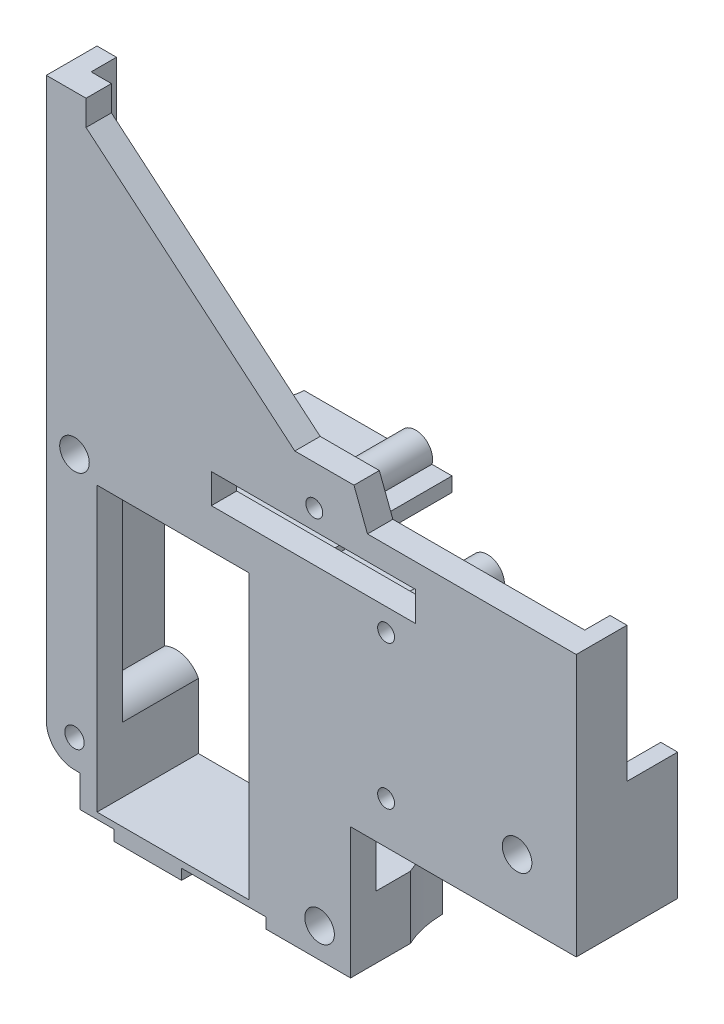
from build123d import *

# Parameters (mm, degrees)
ESQUISSE1_R                   = 1.15
ESQUISSE1_R_2                 = 1.75
ESQUISSE1_R_3                 = 1
ESQUISSE1_W                   = 18
ESQUISSE1_H                   = 33.5
BOSS_EXTRU_2_DEPTH            = 12
ENL_V_MAT_EXTRU_1_DEPTH       = 75.057589753
ESQUISSE3_W                   = 2.3
ESQUISSE3_H                   = 33.5
ESQUISSE3_W_2                 = 2
ESQUISSE3_H_2                 = 16
ENL_V_MAT_EXTRU_2_DEPTH       = 74.753146373
CONG_1_R                      = 3
ENL_V_MAT_EXTRU_3_REACH       = 62.317
ESQUISSE4_R                   = 2.2
ENL_V_MAT_EXTRU_4_REACH       = 67.556
ESQUISSE5_R                   = 3.5
ESQUISSE6_R                   = 3.5
ENL_V_MAT_EXTRU_5_DEPTH       = 5
ESQUISSE7_W                   = 8.040923999
ESQUISSE7_H                   = 1.8
ENL_V_MAT_EXTRU_6_DEPTH       = 1
ENL_V_MAT_EXTRU_7_DEPTH       = 3
ENL_V_MAT_EXTRU_7_DEPTH_BACK  = 75.185757393
ESQUISSE8_W                   = 24.177827552
ESQUISSE8_H                   = 3.5
ENL_V_MAT_EXTRU_8_REACH       = 72.034
ENL_V_MAT_EXTRU_9_REACH       = 76.033
ESQUISSE10_R                  = 4
ESQUISSE11_R                  = 12.099999999
ENL_V_MAT_EXTRU_10_DEPTH      = 76.583950893
ENL_V_MAT_EXTRU_11_DEPTH      = 38
ENL_V_MAT_EXTRU_11_DEPTH_BACK = 1
ESQUISSE17_R                  = 1.5
ENL_V_MAT_EXTRU_12_DEPTH      = 13
ENL_V_MAT_EXTRU_12_DEPTH_BACK = 1.2
ESQUISSE18_R                  = 1.5


with BuildPart() as part:
    # Esquisse1 → Boss.-Extru.2 (new body)
    with BuildSketch(Plane.XY):
        with BuildLine():
            Line((-12.306087575, 57.58118588), (-12.306087575, 54.58118588))
            Line((-12.306087575, 54.58118588), (12.393912425, 33.78118588))
            Line((12.393912425, 33.78118588), (19.393912425, 33.78118588))
            Line((19.393912425, 33.78118588), (20.993912425, 29.58118588))
            Line((20.993912425, 29.58118588), (45.693912425, 29.58118588))
            Line((45.693912425, 29.58118588), (45.693912425, -1.41881412))
            Line((45.693912425, -1.41881412), (18.993912425, -1.41881412))
            Line((18.993912425, -1.41881412), (18.993912425, -16.91881412))
            Line((18.993912425, -16.91881412), (8.993912425, -16.91881412))
            Line((8.993912425, -16.91881412), (8.993912425, -15.66881412))
            Line((8.993912425, -15.66881412), (-1.006087575, -15.66881412))
            Line((-1.006087575, -15.66881412), (-1.006087575, -16.91881412))
            Line((-1.006087575, -16.91881412), (-9.006087575, -16.91881412))
            Line((-9.006087575, -16.91881412), (-9.006087575, -15.66881412))
            Line((-9.006087575, -15.66881412), (-13.006087575, -15.66881412))
            Line((-13.006087575, -15.66881412), (-13.006087575, -11.91881412))
            Line((-13.006087575, -11.91881412), (-13.676087575, -11.91881412))
            ThreePointArc((-13.676087575, -11.91881412), (-16.030753157, -10.943479702), (-17.006087575, -8.58881412))
            Line((-17.006087575, -8.58881412), (-17.006087575, 57.58118588))
            Line((-17.006087575, 57.58118588), (-12.306087575, 57.58118588))
        make_face()
        with Locations((-13.676087575, -8.58881412)):
            Circle(ESQUISSE1_R, mode=Mode.SUBTRACT)
        with Locations((-13.676087575, 20.41118588)):
            Circle(ESQUISSE1_R_2, mode=Mode.SUBTRACT)
        with Locations((15.323912425, -13.41881412)):
            Circle(ESQUISSE1_R_2, mode=Mode.SUBTRACT)
        with Locations((38.693912425, 5.58118588)):
            Circle(ESQUISSE1_R_2, mode=Mode.SUBTRACT)
        with Locations((23.193912425, 3.58118588)):
            Circle(ESQUISSE1_R_3, mode=Mode.SUBTRACT)
        with Locations((23.193912425, 20.58118588)):
            Circle(ESQUISSE1_R_3, mode=Mode.SUBTRACT)
        with Locations((14.693912425, 29.08118588)):
            Circle(ESQUISSE1_R_3, mode=Mode.SUBTRACT)
        with Locations((-2.006087575, 1.83118588)):
            Rectangle(ESQUISSE1_W, ESQUISSE1_H, mode=Mode.SUBTRACT)
    extrude(amount=BOSS_EXTRU_2_DEPTH)

    # Esquisse2 → Enlèv. mat.-Extru.1 (cut, through all)
    # profile 1 of 4: a face of its own
    with BuildSketch(Plane.XY.offset(9)):
        with BuildLine():
            ThreePointArc((25.047962046, 19.83118588), (23.193912425, 22.58118588), (21.339862803, 19.83118588))
            Line((21.339862803, 19.83118588), (11.493912425, 19.83118588))
            Line((11.493912425, 19.83118588), (11.493912425, 20.58118588))
            Line((11.493912425, 20.58118588), (-10.010027019, 20.58118588))
            ThreePointArc((-10.010027019, 20.58118588), (-11.141822396, 23.065691483), (-13.676087575, 24.08118588))
            Line((-13.676087575, 24.08118588), (-14.706087575, 24.08118588))
            Line((-14.706087575, 24.08118588), (-14.706087575, 57.58118588))
            Line((-14.706087575, 57.58118588), (-12.306087575, 57.58118588))
            Line((-12.306087575, 57.58118588), (-12.306087575, 54.58118588))
            Line((-12.306087575, 54.58118588), (12.393912425, 33.78118588))
            Line((12.393912425, 33.78118588), (19.393912425, 33.78118588))
            Line((19.393912425, 33.78118588), (20.993912425, 29.58118588))
            Line((20.993912425, 29.58118588), (43.693912425, 29.58118588))
            Line((43.693912425, 29.58118588), (43.693912425, 6.58118588))
            Line((43.693912425, 6.58118588), (42.048014391, 6.58118588))
            ThreePointArc((42.048014391, 6.58118588), (38.693912425, 9.08118588), (35.339810458, 6.58118588))
            Line((35.339810458, 6.58118588), (26.693912425, 6.58118588))
            Line((26.693912425, 6.58118588), (26.693912425, 5.88118588))
            Line((26.693912425, 5.88118588), (6.993912425, 5.88118588))
            Line((6.993912425, 5.88118588), (6.993912425, 15.83118588))
            Line((6.993912425, 15.83118588), (11.493912425, 15.83118588))
            Line((11.493912425, 15.83118588), (11.493912425, 17.83118588))
            Line((11.493912425, 17.83118588), (31.493912425, 17.83118588))
            Line((31.493912425, 17.83118588), (31.493912425, 19.83118588))
            Line((31.493912425, 19.83118588), (25.047962046, 19.83118588))
        make_face()
        with BuildLine():
            ThreePointArc((16.616800877, 28.53118588), (14.693912425, 31.08118588), (12.771023972, 28.53118588))
            Line((12.771023972, 28.53118588), (-2.006087575, 28.53118588))
            Line((-2.006087575, 28.53118588), (-2.006087575, 26.83118588))
            Line((-2.006087575, 26.83118588), (18.993912425, 26.83118588))
            Line((18.993912425, 26.83118588), (18.993912425, 28.53118588))
            Line((18.993912425, 28.53118588), (16.616800877, 28.53118588))
        make_face(mode=Mode.SUBTRACT)
    # profile 2 of 4: a face of its own
    with BuildSketch(Plane.XY.offset(9)):
        with BuildLine():
            ThreePointArc((20.964002112, 3.88118588), (21.206819115, 2.52574276), (22.193912425, 1.565621443))
            Line((22.193912425, 1.565621443), (22.193912425, 0.58118588))
            Line((22.193912425, 0.58118588), (18.993912425, 0.58118588))
            Line((18.993912425, 0.58118588), (18.993912425, -9.51881412))
            Line((18.993912425, -9.51881412), (9.993912425, -9.51881412))
            Line((9.993912425, -9.51881412), (9.993912425, -14.91881412))
            Line((9.993912425, -14.91881412), (6.993912425, -14.91881412))
            Line((6.993912425, -14.91881412), (6.993912425, 3.88118588))
            Line((6.993912425, 3.88118588), (20.964002112, 3.88118588))
        make_face()
    # profile 3 of 4: a face of its own
    with BuildSketch(Plane.XY.offset(9)):
        with BuildLine():
            ThreePointArc((-15.006087575, 17.173733177), (-12.847657165, 17.010641356), (-11.006087575, 18.148201125))
            Line((-11.006087575, 18.148201125), (-11.006087575, -7.220932547))
            ThreePointArc((-11.006087575, -7.220932547), (-12.735191712, -5.740180242), (-15.006087575, -5.899743649))
            Line((-15.006087575, -5.899743649), (-15.006087575, 17.173733177))
        make_face()
    # profile 4 of 4: a face of its own
    with BuildSketch(Plane.XY.offset(9)):
        with BuildLine():
            ThreePointArc((24.193912425, 1.565621443), (25.181005734, 2.52574276), (25.423822737, 3.88118588))
            Line((25.423822737, 3.88118588), (29.193912425, 3.88118588))
            Line((29.193912425, 3.88118588), (29.193912425, 4.58118588))
            Line((29.193912425, 4.58118588), (35.339810458, 4.58118588))
            ThreePointArc((35.339810458, 4.58118588), (38.693912425, 2.08118588), (42.048014391, 4.58118588))
            Line((42.048014391, 4.58118588), (43.693912425, 4.58118588))
            Line((43.693912425, 4.58118588), (43.693912425, 0.58118588))
            Line((43.693912425, 0.58118588), (24.193912425, 0.58118588))
            Line((24.193912425, 0.58118588), (24.193912425, 1.565621443))
        make_face()
    extrude(amount=-ENL_V_MAT_EXTRU_1_DEPTH, mode=Mode.SUBTRACT)

    # Esquisse3 → Enlèv. mat.-Extru.2 (cut, through all)
    with BuildSketch(Plane.XY.offset(6)):
        with Locations((-15.856087575, 40.83118588)):
            Rectangle(ESQUISSE3_W, ESQUISSE3_H)
        with Locations((44.693912425, 21.58118588)):
            Rectangle(ESQUISSE3_W_2, ESQUISSE3_H_2)
    extrude(amount=-ENL_V_MAT_EXTRU_2_DEPTH, mode=Mode.SUBTRACT)

    # Congé1
    cong_1_edges = [part.edges().sort_by_distance(p)[0] for p in [
        (9.993912425, -9.51881412, 4.5),
    ]]
    fillet(cong_1_edges, radius=CONG_1_R)

    # Esquisse4 → Enlèv. mat.-Extru.3 (cut, up to next)
    with BuildSketch(Plane(origin=(0, 20.58118588, 0), x_dir=(1, 0, 0), z_dir=(0, 1, 0)), mode=Mode.PRIVATE) as enl_v_mat_extru_3_sk1:
        with Locations((-2.006087575, 0)):
            Circle(ESQUISSE4_R)
    enl_v_mat_extru_3_tool1 = extrude(enl_v_mat_extru_3_sk1.sketch, amount=-ENL_V_MAT_EXTRU_3_REACH, mode=Mode.PRIVATE) & part.part
    add(enl_v_mat_extru_3_tool1.solids().sort_by_distance((-2.006088, 20.581186, 0))[0], mode=Mode.SUBTRACT)

    # Esquisse5 → Enlèv. mat.-Extru.4 (cut, up to next)
    with BuildSketch(Plane(origin=(0, 28.53118588, 0), x_dir=(1, 0, 0), z_dir=(0, 1, 0)), mode=Mode.PRIVATE) as enl_v_mat_extru_4_sk1:
        with Locations((-2.017786304, -0.014313461)):
            Circle(ESQUISSE5_R)
    enl_v_mat_extru_4_tool1 = extrude(enl_v_mat_extru_4_sk1.sketch, amount=-ENL_V_MAT_EXTRU_4_REACH, mode=Mode.PRIVATE) & part.part
    add(enl_v_mat_extru_4_tool1.solids().sort_by_distance((-2.017786, 28.531186, 0.014313))[0], mode=Mode.SUBTRACT)

    # Esquisse6 → Enlèv. mat.-Extru.5 (cut)
    with BuildSketch(Plane(origin=(0, 19.83118588, 0), x_dir=(1, 0, 0), z_dir=(0, 1, 0))):
        with Locations((14.993912425, 0)):
            Circle(ESQUISSE6_R)
    extrude(amount=-ENL_V_MAT_EXTRU_5_DEPTH, mode=Mode.SUBTRACT)

    # Esquisse7 → Enlèv. mat.-Extru.6 (cut)
    with BuildSketch(Plane(origin=(0, 0, 9), x_dir=(-1, 0, 0), z_dir=(0, 0, -1))):
        with Locations((2.077482888, 31.18118588)):
            Rectangle(ESQUISSE7_W, ESQUISSE7_H)
    extrude(amount=-ENL_V_MAT_EXTRU_6_DEPTH, mode=Mode.SUBTRACT)

    # Esquisse8 → Enlèv. mat.-Extru.7 (cut, two sides: drawn at the far end of the back side and taken through both)
    with BuildSketch(Plane(origin=(0, 0, 10), x_dir=(-1, 0, 0), z_dir=(0, 0, -1)).offset(-ENL_V_MAT_EXTRU_7_DEPTH_BACK)):
        with Locations((-14.607691418, 24.992571009)):
            Rectangle(ESQUISSE8_W, ESQUISSE8_H)
    extrude(amount=ENL_V_MAT_EXTRU_7_DEPTH + ENL_V_MAT_EXTRU_7_DEPTH_BACK, mode=Mode.SUBTRACT)

    # Esquisse9 → Enlèv. mat.-Extru.8 (cut, up to next)
    with BuildSketch(Plane(origin=(0, 5.88118588, 0), x_dir=(1, 0, 0), z_dir=(0, 1, 0)), mode=Mode.PRIVATE) as enl_v_mat_extru_8_sk1:
        with BuildLine():
            Line((19.993912425, 0), (6.993912425, 0))
            Line((6.993912425, 0), (6.993912425, -5))
            Line((6.993912425, -5), (14.993912425, -5))
            ThreePointArc((14.993912425, -5), (18.529446331, -3.535533906), (19.993912425, 0))
        make_face()
    enl_v_mat_extru_8_tool1 = extrude(enl_v_mat_extru_8_sk1.sketch, amount=-ENL_V_MAT_EXTRU_8_REACH, mode=Mode.PRIVATE) & part.part
    add(enl_v_mat_extru_8_tool1.solids().sort_by_distance((13.009618, 5.881186, 2.375564))[0], mode=Mode.SUBTRACT)

    # Esquisse10 → Enlèv. mat.-Extru.9 (cut, up to next)
    with BuildSketch(Plane(origin=(0, 0.58118588, 0), x_dir=(1, 0, 0), z_dir=(0, 1, 0)), mode=Mode.PRIVATE) as enl_v_mat_extru_9_sk1:
        with Locations((29.993541661, 0.105464602)):
            Circle(ESQUISSE10_R)
    enl_v_mat_extru_9_tool1 = extrude(enl_v_mat_extru_9_sk1.sketch, amount=-ENL_V_MAT_EXTRU_9_REACH, mode=Mode.PRIVATE) & part.part
    add(enl_v_mat_extru_9_tool1.solids().sort_by_distance((29.993542, 0.581186, -0.105465))[0], mode=Mode.SUBTRACT)

    # Esquisse11 → Enlèv. mat.-Extru.10 (cut, through all)
    with BuildSketch(Plane.XZ.offset(1.41881412)):
        with Locations((29.993541661, -0.105464602)):
            Circle(ESQUISSE11_R)
    extrude(amount=ENL_V_MAT_EXTRU_10_DEPTH, mode=Mode.SUBTRACT)

    # Esquisse17 → Enlèv. mat.-Extru.11 (cut, two sides: drawn at the far end of the back side and taken through both)
    with BuildSketch(Plane.XZ.offset(-26.83118588).offset(-ENL_V_MAT_EXTRU_11_DEPTH_BACK)):
        with Locations((14.993912425, 0)):
            Circle(ESQUISSE17_R)
    extrude(amount=ENL_V_MAT_EXTRU_11_DEPTH + ENL_V_MAT_EXTRU_11_DEPTH_BACK, mode=Mode.SUBTRACT)

    # Esquisse18 → Enlèv. mat.-Extru.12 (cut, two sides: drawn at the far end of the back side and taken through both)
    with BuildSketch(Plane.XZ.offset(-17.83118588).offset(-ENL_V_MAT_EXTRU_12_DEPTH_BACK)):
        with Locations((23.993912425, 0)):
            Circle(ESQUISSE18_R)
    extrude(amount=ENL_V_MAT_EXTRU_12_DEPTH + ENL_V_MAT_EXTRU_12_DEPTH_BACK, mode=Mode.SUBTRACT)


solid = part.part
